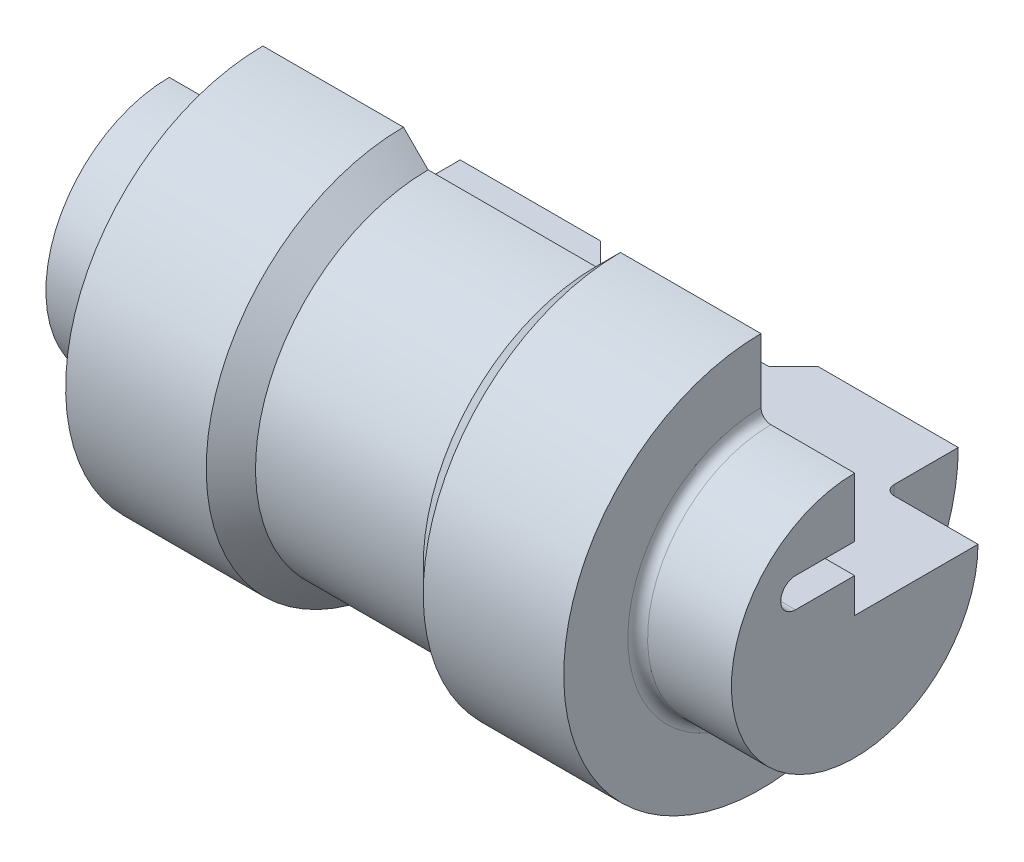
from build123d import *

# Parameters (mm, degrees)
REVOLVE2_ANGLE     = 270
CUT_EXTRUDE1_DEPTH = 151.069983674


with BuildPart() as part:
    # Sketch1 → Revolve2 (revolve)
    with BuildSketch(Plane.XY):
        with BuildLine():
            Line((0, 0), (139, 0))
            Line((139, 0), (139, 25))
            Line((139, 25), (122, 25))
            ThreePointArc((122, 25), (120.585786438, 25.585786438), (120, 27))
            Line((120, 27), (120, 40))
            Line((120, 40), (91.5, 40))
            Line((91.5, 40), (86.5, 35))
            Line((86.5, 35), (52.5, 35))
            Line((52.5, 35), (47.5, 40))
            Line((47.5, 40), (19, 40))
            Line((19, 40), (19, 27))
            ThreePointArc((19, 27), (18.414213562, 25.585786438), (17, 25))
            Line((17, 25), (0, 25))
            Line((0, 25), (0, 0))
        make_face()
    revolve(axis=Axis((0, 0, 0), (1, 0, 0)), revolution_arc=REVOLVE2_ANGLE)

    # Sketch2 → Cut-Extrude1 (cut, through all)
    with BuildSketch(Plane(origin=(139, 0, 0), x_dir=(0, 0, -1), z_dir=(1, 0, 0))):
        with BuildLine():
            Line((0, 7), (-12, 7))
            ThreePointArc((-12, 7), (-15, 10), (-12, 13))
            Line((-12, 13), (0, 13))
            Line((0, 13), (0, 7))
        make_face()
    extrude(amount=-CUT_EXTRUDE1_DEPTH, mode=Mode.SUBTRACT)


solid = part.part
